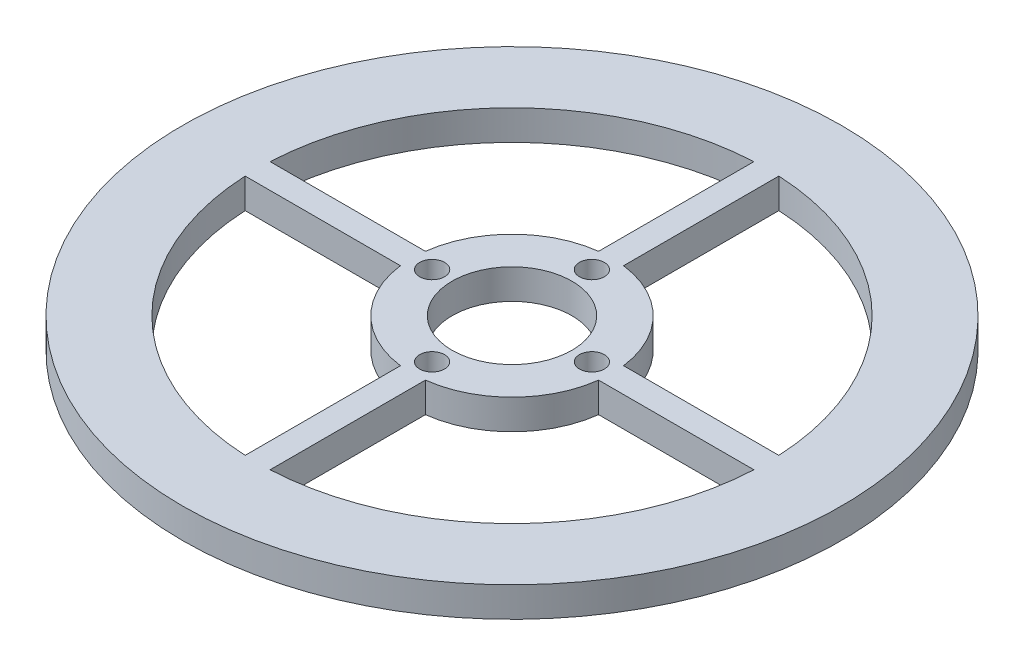
from build123d import *

# Parameters (mm, degrees)
SKETCH_1_R      = 33
SKETCH_1_R_2    = 25.5
SKETCH_1_R_3    = 10
SKETCH_1_R_4    = 1.25
SKETCH_1_R_5    = 6
EXTRUDE_1_DEPTH = 3


with BuildPart() as part:
    # 草图1 → 凸台-拉伸1 (new body)
    # profile 1 of 6: a face of its own
    with BuildSketch(Plane(origin=(0, 0, 0), x_dir=(1, 0, 0), z_dir=(0, 1, 0))):
        with Locations(Location((0, 0, 0), (0, 0, 270))):
            Circle(SKETCH_1_R)
        Circle(SKETCH_1_R_2, mode=Mode.SUBTRACT)
    # profile 2 of 6: a face of its own
    with BuildSketch(Plane(origin=(0, 0, 0), x_dir=(1, 0, 0), z_dir=(0, 1, 0))):
        with BuildLine():
            ThreePointArc((-9.921567416, -1.25), (-10, 0), (-9.921567416, 1.25))
            Line((-9.921567416, 1.25), (-25.469344318, 1.25))
            ThreePointArc((-25.469344318, 1.25), (-25.5, 0), (-25.469344318, -1.25))
            Line((-25.469344318, -1.25), (-9.921567416, -1.25))
        make_face()
    # profile 3 of 6: a face of its own
    with BuildSketch(Plane(origin=(0, 0, 0), x_dir=(1, 0, 0), z_dir=(0, 1, 0))):
        with BuildLine():
            ThreePointArc((-1.25, 9.921567416), (0, 10), (1.25, 9.921567416))
            Line((1.25, 9.921567416), (1.25, 25.469344318))
            ThreePointArc((1.25, 25.469344318), (0, 25.5), (-1.25, 25.469344318))
            Line((-1.25, 25.469344318), (-1.25, 9.921567416))
        make_face()
    # profile 4 of 6: a face of its own
    with BuildSketch(Plane(origin=(0, 0, 0), x_dir=(1, 0, 0), z_dir=(0, 1, 0))):
        Circle(SKETCH_1_R_3)
        with Locations(Location((8, 0, 0), (0, 0, 270))):
            Circle(SKETCH_1_R_4, mode=Mode.SUBTRACT)
        with Locations(Location((0, -8, 0), (0, 0, 270))):
            Circle(SKETCH_1_R_4, mode=Mode.SUBTRACT)
        with Locations(Location((-8, 0, 0), (0, 0, 270))):
            Circle(SKETCH_1_R_4, mode=Mode.SUBTRACT)
        with Locations(Location((0, 8, 0), (0, 0, 270))):
            Circle(SKETCH_1_R_4, mode=Mode.SUBTRACT)
        with Locations(Location((0, 0, 0), (0, 0, 270))):
            Circle(SKETCH_1_R_5, mode=Mode.SUBTRACT)
    # profile 5 of 6: a face of its own
    with BuildSketch(Plane(origin=(0, 0, 0), x_dir=(1, 0, 0), z_dir=(0, 1, 0))):
        with BuildLine():
            Line((25.469344318, 1.25), (9.921567416, 1.25))
            ThreePointArc((9.921567416, 1.25), (9.980372592, 0.626229125), (10, 0))
            ThreePointArc((10, 0), (9.980372592, -0.626229125), (9.921567416, -1.25))
            Line((9.921567416, -1.25), (25.469344318, -1.25))
            ThreePointArc((25.469344318, -1.25), (25.492334928, -0.625187926), (25.5, 0))
            ThreePointArc((25.5, 0), (25.492334928, 0.625187926), (25.469344318, 1.25))
        make_face()
    # profile 6 of 6: a face of its own
    with BuildSketch(Plane(origin=(0, 0, 0), x_dir=(1, 0, 0), z_dir=(0, 1, 0))):
        with BuildLine():
            Line((1.25, -25.469344318), (1.25, -9.921567416))
            ThreePointArc((1.25, -9.921567416), (0, -10), (-1.25, -9.921567416))
            Line((-1.25, -9.921567416), (-1.25, -25.469344318))
            ThreePointArc((-1.25, -25.469344318), (0, -25.5), (1.25, -25.469344318))
        make_face()
    extrude(amount=EXTRUDE_1_DEPTH)


solid = part.part
